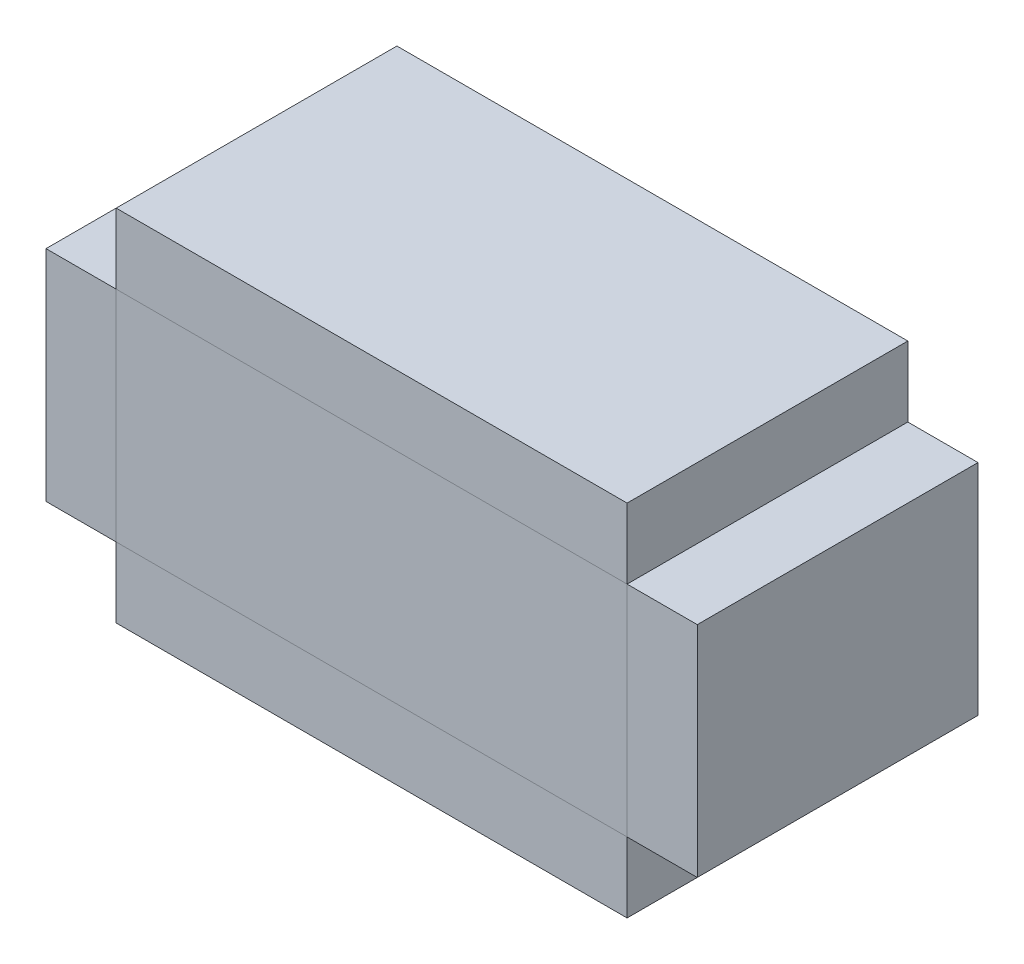
from build123d import *

# Parameters (mm, degrees)
SKETCH1_W           = 57.785
SKETCH1_H           = 24.765
BOSS_EXTRUDE1_DEPTH = 15.875
SKETCH2_W           = 7.9375
SKETCH2_H           = 24.765
SKETCH2_W_2         = 57.785
SKETCH2_H_2         = 7.9375
BOSS_EXTRUDE2_DEPTH = 31.75


with BuildPart() as part:
    # Sketch1 → Boss-Extrude1 (new, symmetric)
    with BuildSketch(Plane.XY):
        with Locations((0, -2.8575)):
            Rectangle(SKETCH1_W, SKETCH1_H)
    extrude(amount=BOSS_EXTRUDE1_DEPTH, both=True)


with BuildPart() as body_2:
    # Sketch2 → Boss-Extrude2 (new body)
    with BuildSketch(Plane(origin=(0, 0, -15.875), x_dir=(-1, 0, 0), z_dir=(0, 0, -1))):
        with Locations((-32.86125, -2.8575)):
            Rectangle(SKETCH2_W, SKETCH2_H)
        with Locations((0, -19.20875)):
            Rectangle(SKETCH2_W_2, SKETCH2_H_2)
        with Locations((0, 13.49375)):
            Rectangle(SKETCH2_W_2, SKETCH2_H_2)
        with Locations((32.86125, -2.8575)):
            Rectangle(SKETCH2_W, SKETCH2_H)
    extrude(amount=-BOSS_EXTRUDE2_DEPTH)


solid = Compound([part.part, body_2.part])
